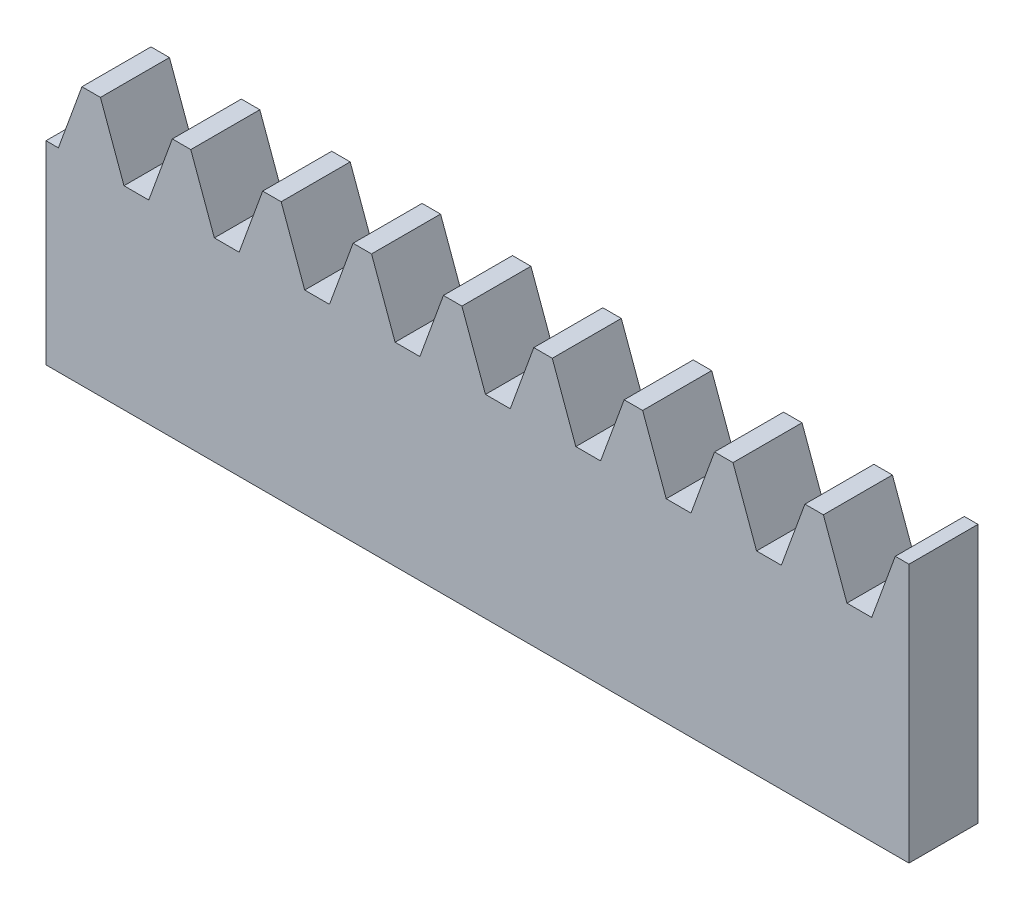
from build123d import *

# Parameters (mm, degrees)
BLANKSKE_W        = 150
BLANKSKE_H        = 45
BLANK_DEPTH       = 12
TOOTHCUTSIM_DEPTH = 158.063681353
TEETHCUTS_COUNT   = 10
TEETHCUTS_PITCH   = 15.70796325


with BuildPart() as part:
    # BlankSke → Blank (new body)
    with BuildSketch(Plane.XY):
        with Locations((75, 22.5)):
            Rectangle(BLANKSKE_W, BLANKSKE_H)
    extrude(amount=-BLANK_DEPTH)

    # TooCutSkeSim → ToothCutSim (cut, through all)
    with BuildSketch(Plane.XY):
        Polygon((2.153176848, 33.75), (-2.153176848, 33.75), (-6.257086828, 45.0254), (6.257086828, 45.0254), align=None)
    toothcutsim = extrude(amount=-TOOTHCUTSIM_DEPTH, mode=Mode.SUBTRACT)

    # TeethCuts: ToothCutSim ×10
    with Locations(*[(i * TEETHCUTS_PITCH, 0, 0) for i in range(1, TEETHCUTS_COUNT)]):
        add(toothcutsim, mode=Mode.SUBTRACT)


solid = part.part
